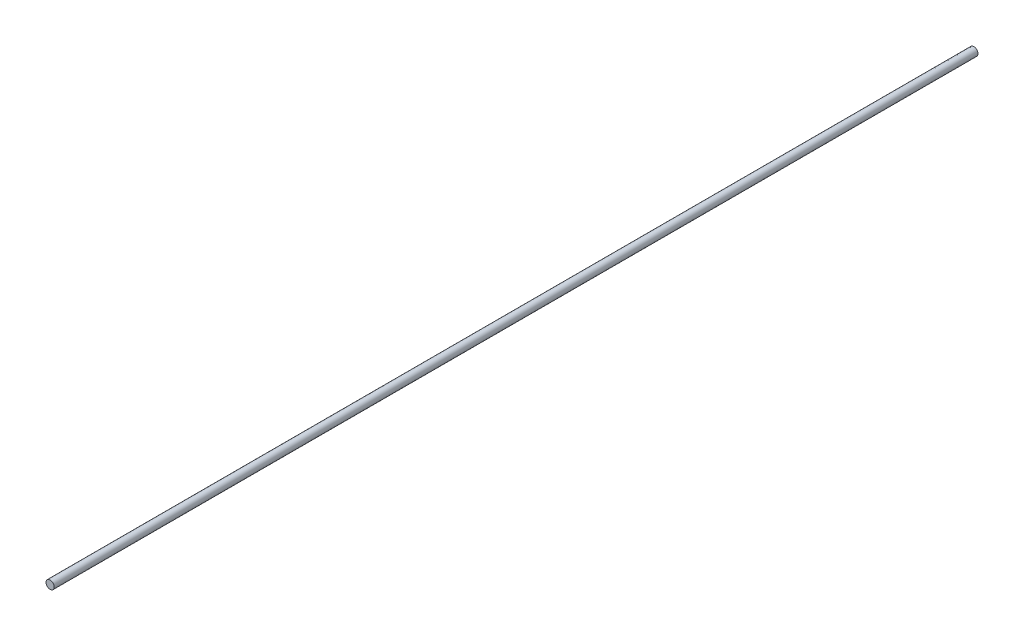
from build123d import *

# Parameters (mm, degrees)
SKETCH1_R           = 2.5
BOSS_EXTRUDE1_DEPTH = 563


with BuildPart() as part:
    # Sketch1 → Boss-Extrude1 (new body)
    with BuildSketch(Plane.XY):
        Circle(SKETCH1_R)
    extrude(amount=BOSS_EXTRUDE1_DEPTH)


solid = part.part
